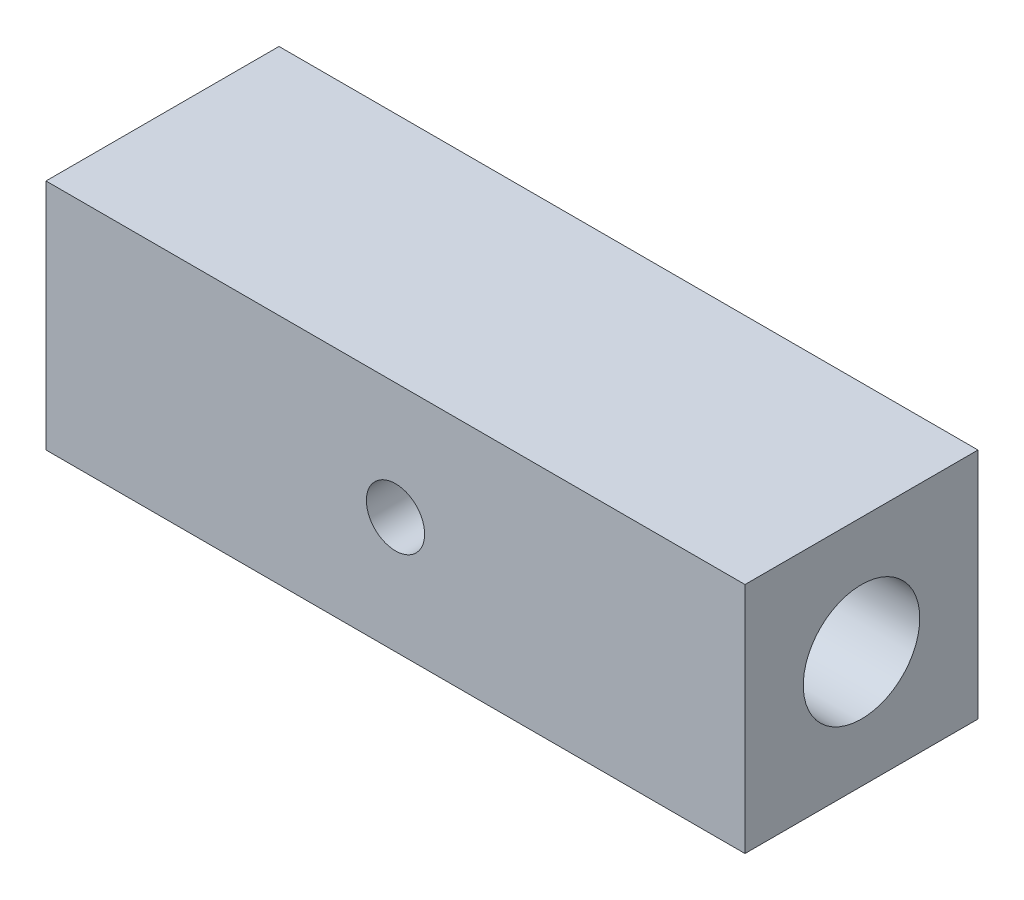
from build123d import *

# Parameters (mm, degrees)
SKETCH1_W           = 76.2
SKETCH1_H           = 25.4
SKETCH1_R           = 3.175
BOSS_EXTRUDE1_DEPTH = 25.4
SKETCH2_R           = 6.35
CUT_EXTRUDE1_DEPTH  = 85.242269675
SCALE1_SCALE        = 1.5
SCALE2_SCALE        = 0.67


with BuildPart() as part:
    # Sketch1 → Boss-Extrude1 (new body)
    with BuildSketch(Plane.XY):
        with Locations((-38.1, 12.7)):
            Rectangle(SKETCH1_W, SKETCH1_H)
        with Locations((-38.1, 12.7)):
            Circle(SKETCH1_R, mode=Mode.SUBTRACT)
    extrude(amount=BOSS_EXTRUDE1_DEPTH)

    # Sketch2 → Cut-Extrude1 (cut, through all)
    with BuildSketch(Plane(origin=(0, 0, 0), x_dir=(0, 0, -1), z_dir=(1, 0, 0))):
        with Locations((-12.7, 12.7)):
            Circle(SKETCH2_R)
    extrude(amount=-CUT_EXTRUDE1_DEPTH, mode=Mode.SUBTRACT)


with BuildPart() as part_1:
    # Scale1: scaled about (-38.100000058, 12.700000154, 12.700000148)
    add(part.part.scale(SCALE1_SCALE).moved(Location((19.050000029, -6.350000077, -6.350000074))))


with BuildPart() as part_2:
    # Scale2: scaled about (-38.100000058, 12.700000155, 12.700000148)
    add(part_1.part.scale(SCALE2_SCALE).moved(Location((-12.573000019, 4.191000051, 4.191000049))))


solid = part_2.part
